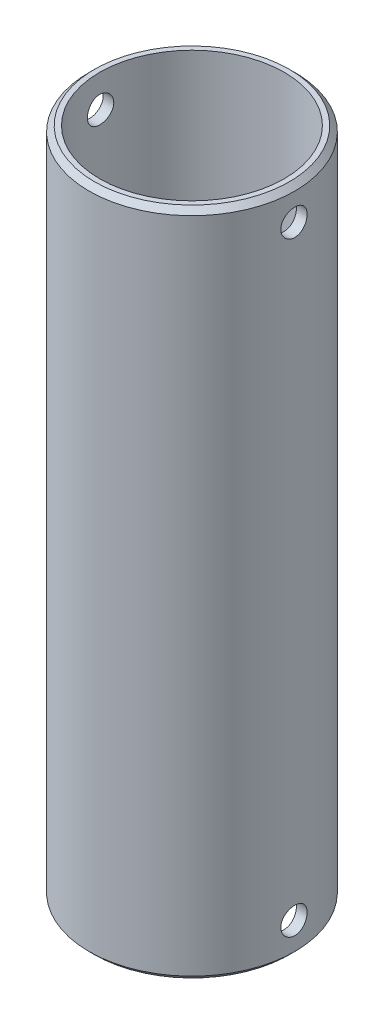
from build123d import *

# Parameters (mm, degrees)
SKETCH1_R                   = 9.525
SKETCH1_R_2                 = 8.5471
BOSS_EXTRUDE1_DEPTH         = 31
F_41_0_096_DIAMETER_HOLE1_D = 2.4384
CHAMFER1_SIZE               = 0.5


with BuildPart() as part:
    # Sketch1 → Boss-Extrude1 (new, symmetric)
    with BuildSketch(Plane(origin=(0, 0, 0), x_dir=(1, 0, 0), z_dir=(0, 1, 0))):
        Circle(SKETCH1_R)
        Circle(SKETCH1_R_2, mode=Mode.SUBTRACT)
    extrude(amount=BOSS_EXTRUDE1_DEPTH, both=True)

    # #41 (0.096) Diameter Hole1 (through all)
    with Locations(Plane.ZY.offset(9.525)):
        with Locations((0, 28), (0, -28)):
            Hole(F_41_0_096_DIAMETER_HOLE1_D / 2)

    # Chamfer1
    chamfer1_edges = [part.edges().sort_by_distance(p)[0] for p in [
        (-9.525, 31, 0),
        (-9.525, -31, 0),
    ]]
    chamfer(chamfer1_edges, length=CHAMFER1_SIZE)


solid = part.part
